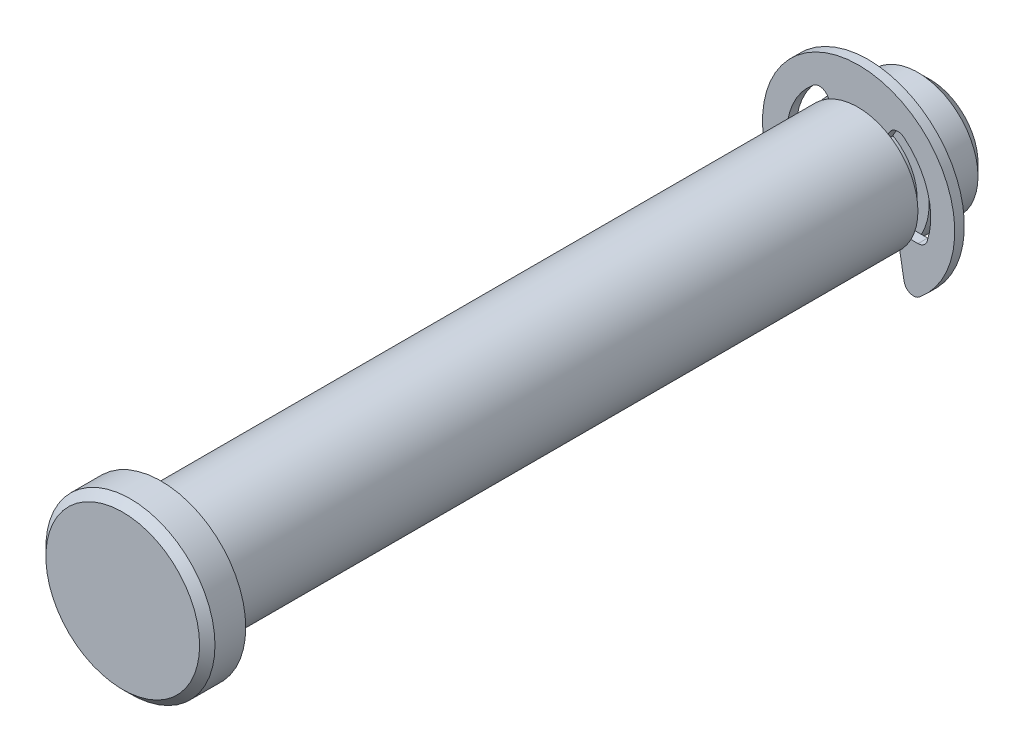
from build123d import *

# Parameters (mm, degrees)
SKETCH2_R      = 3.96875
EXTRUDE1_DEPTH = 25.4
SKETCH3_W      = 0.7366
SKETCH3_H      = 0.79375
SKETCH8_R      = 5.588
EXTRUDE6_DEPTH = 2.54
CHAMFER2_SIZE  = 0.508
SKETCH4_R      = 6.35
SKETCH4_R_2    = 3.175
EXTRUDE2_DEPTH = 0.3175
EXTRUDE4_DEPTH = 30.347718821
EXTRUDE5_DEPTH = 0.635
FILLET1_R      = 0.635
CHAMFER1_SIZE  = 0.79375


with BuildPart() as part:
    # Sketch2 → Extrude1 (new, symmetric)
    with BuildSketch(Plane.XY):
        Circle(SKETCH2_R)
    extrude(amount=EXTRUDE1_DEPTH, both=True)

    # Sketch3 → Cut-Revolve1 (revolve, cut)
    with BuildSketch(Plane(origin=(0, 0, 0), x_dir=(0, 0, -1), z_dir=(1, 0, 0)), mode=Mode.PRIVATE) as cut_revolve1_sk:
        with Locations((21.0058, 3.571875)):
            Rectangle(SKETCH3_W, SKETCH3_H)
    revolve(cut_revolve1_sk.sketch.rotate(Axis((0, 0, 25.4), (0, 0, -1)), 90), axis=Axis((0, 0, 25.4), (0, 0, -1)), mode=Mode.SUBTRACT)

    # Sketch8 → Extrude6 (add)
    with BuildSketch(Plane.XY.offset(25.4)):
        Circle(SKETCH8_R)
    extrude(amount=EXTRUDE6_DEPTH)

    # Chamfer2
    chamfer2_edges = [part.edges().sort_by_distance(p)[0] for p in [
        (-5.588, 0, 27.94),
    ]]
    chamfer(chamfer2_edges, length=CHAMFER2_SIZE)

    # Chamfer1
    chamfer1_edges = [part.edges().sort_by_distance(p)[0] for p in [
        (-3.96875, 0, -25.4),
    ]]
    chamfer(chamfer1_edges, length=CHAMFER1_SIZE)


with BuildPart() as body_2:
    # Sketch4 → Extrude2 (new, symmetric)
    with BuildSketch(Plane.XY.offset(-21.0058)):
        Circle(SKETCH4_R)
        Circle(SKETCH4_R_2, mode=Mode.SUBTRACT)
    extrude(amount=EXTRUDE2_DEPTH, both=True)

    # Sketch5 → Extrude4 (cut, through all)
    with BuildSketch(Plane.XY):
        with BuildLine():
            Line((-2.38125, 4.124445986), (0, 0))
            Line((0, 0), (2.38125, 4.124445986))
            ThreePointArc((2.38125, 4.124445986), (4.523958552, 1.488356568), (4.364903349, -1.905))
            Line((4.364903349, -1.905), (2.54, -1.905))
            Line((2.54, -1.905), (3.173879308, -5.499908194))
            ThreePointArc((3.173879308, -5.499908194), (0, -6.35), (-3.173879308, -5.499908194))
            Line((-3.173879308, -5.499908194), (-2.54, -1.905))
            Line((-2.54, -1.905), (-4.364903349, -1.905))
            ThreePointArc((-4.364903349, -1.905), (-4.523958552, 1.488356568), (-2.38125, 4.124445986))
        make_face()
    extrude(amount=-EXTRUDE4_DEPTH, mode=Mode.SUBTRACT)

    # Sketch6 → Extrude5 (add)
    with BuildSketch(Plane.XY.offset(-20.6883)):
        with BuildLine():
            Line((-1.5875, 2.749630657), (1.5875, 2.749630657))
            ThreePointArc((1.5875, 2.749630657), (0, 3.175), (-1.5875, 2.749630657))
        make_face()
    extrude(amount=-EXTRUDE5_DEPTH)

    # Fillet1
    fillet1_edges = [body_2.edges().sort_by_distance(p)[0] for p in [
        (2.38125, 4.124445986, -21.0058),
        (3.173879308, -5.499908194, -21.0058),
        (-4.364903349, -1.905, -21.0058),
        (4.364903349, -1.905, -21.0058),
        (-3.173879308, -5.499908194, -21.0058),
        (-2.38125, 4.124445986, -21.0058),
    ]]
    fillet(fillet1_edges, radius=FILLET1_R)


solid = Compound([part.part, body_2.part])
